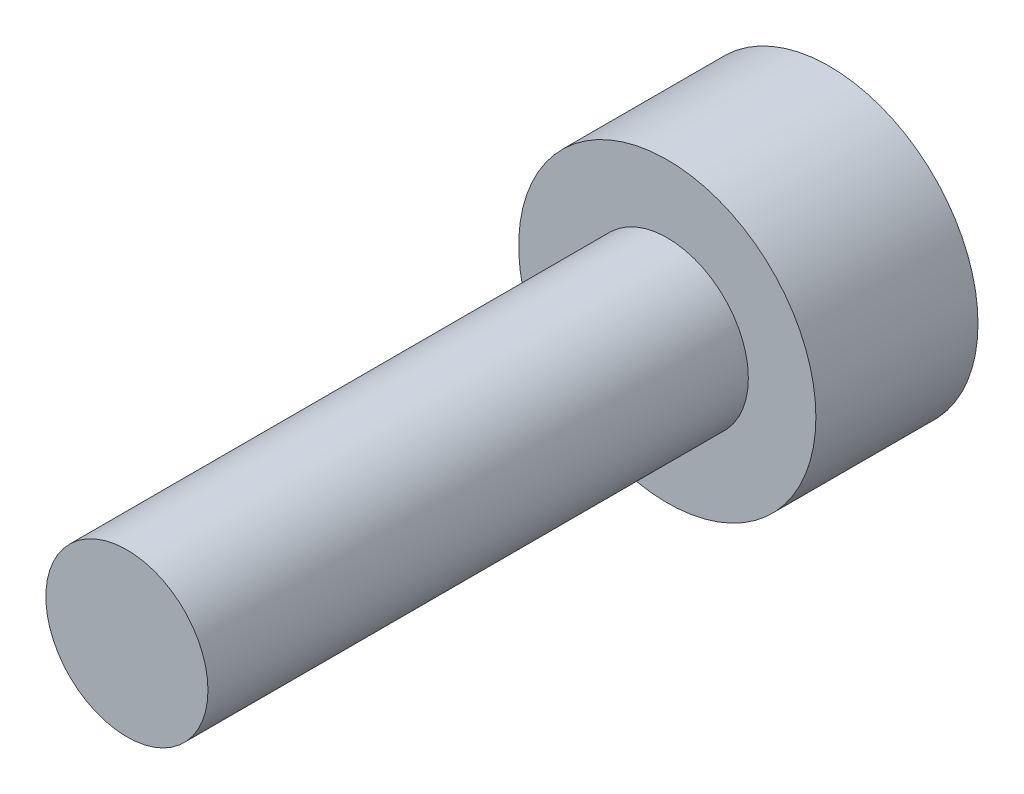
from build123d import *

# Parameters (mm, degrees)
HEAD_ENVELOPE_START         = -3
SKETCH1_R                   = 2.75
HEAD_ENVELOPE_DEPTH         = 3
SKETCH2_R                   = 1.5
THREAD_MAJOR_ENVELOPE_DEPTH = 10


with BuildPart() as part:
    # Sketch1 → Head_Envelope (new body)
    with BuildSketch(Plane.XY.offset(HEAD_ENVELOPE_START)):
        Circle(SKETCH1_R)
    extrude(amount=HEAD_ENVELOPE_DEPTH)

    # Sketch2 → Thread_Major_Envelope (add)
    with BuildSketch(Plane.XY):
        Circle(SKETCH2_R)
    extrude(amount=THREAD_MAJOR_ENVELOPE_DEPTH)


solid = part.part
